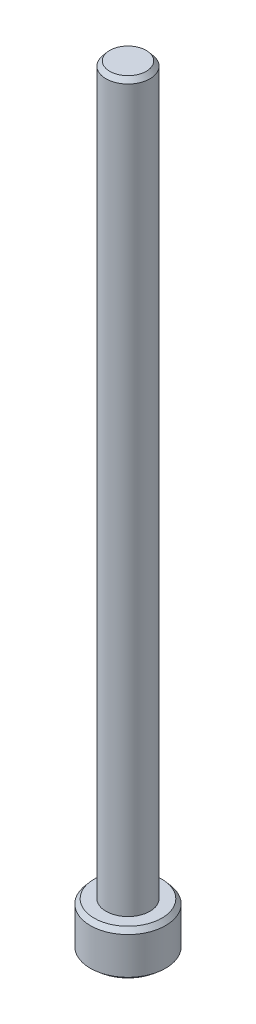
from build123d import *
from OCP.BRepFilletAPI import BRepFilletAPI_MakeChamfer

# Parameters (mm, degrees)
SKETCH1_R           = 4.15
BOSS_EXTRUDE1_DEPTH = 5
SKETCH2_R           = 2.425
BOSS_EXTRUDE2_DEPTH = 80
CUT_EXTRUDE1_DEPTH  = 3
CHAMFER1_SIZE       = 0.5
CHAMFER1_SIZE2      = 0.419549816


with BuildPart() as part:
    # Sketch1 → Boss-Extrude1 (new body)
    with BuildSketch(Plane(origin=(0, 0, 0), x_dir=(1, 0, 0), z_dir=(0, 1, 0))):
        with Locations(Location((0, 0, 0), (0, 0, 270))):
            Circle(SKETCH1_R)
    extrude(amount=BOSS_EXTRUDE1_DEPTH)

    # Sketch2 → Boss-Extrude2 (add)
    with BuildSketch(Plane(origin=(0, 5, 0), x_dir=(1, 0, 0), z_dir=(0, 1, 0))):
        with Locations(Location((0, 0, 0), (0, 0, 270))):
            Circle(SKETCH2_R)
    extrude(amount=BOSS_EXTRUDE2_DEPTH)

    # Sketch3 → Cut-Extrude1 (cut)
    with BuildSketch(Plane.XZ):
        Polygon((0, 2.786041865), (-2.412783031, 1.393020932), (-2.412783031, -1.393020932), (0, -2.786041865), (2.412783031, -1.393020932), (2.412783031, 1.393020932), align=None)
    extrude(amount=-CUT_EXTRUDE1_DEPTH, mode=Mode.SUBTRACT)

    # Chamfer1: one chamfer whose edges measure the first distance from different faces: ONE call of the kernel's chamfer builder (chamfer() names one face for all edges)
    chamfer1_edges_1 = [part.edges().sort_by_distance(p)[0] for p in [
        (0, 0, -4.15),
    ]]
    chamfer1_side_1 = [part.faces().sort_by_distance(p)[0] for p in [
        (0, 0, -4.032620274),
    ]]
    chamfer1_edges_2 = [part.edges().sort_by_distance(p)[0] for p in [
        (0, 5, -4.15),
    ]]
    chamfer1_side_2 = [part.faces().sort_by_distance(p)[0] for p in [
        (0, 2.5, -4.15),
    ]]
    chamfer1_edges_3 = [part.edges().sort_by_distance(p)[0] for p in [
        (0, 85, -2.425),
    ]]
    chamfer1_side_3 = [part.faces().sort_by_distance(p)[0] for p in [
        (0, 45, -2.425),
    ]]
    chamfer1 = BRepFilletAPI_MakeChamfer(part.part.solid().wrapped)
    for e in chamfer1_edges_1:
        chamfer1.Add(CHAMFER1_SIZE, CHAMFER1_SIZE2, e.wrapped, chamfer1_side_1[0].wrapped)  # the first distance lies on this face
    for e in chamfer1_edges_2:
        chamfer1.Add(CHAMFER1_SIZE, CHAMFER1_SIZE2, e.wrapped, chamfer1_side_2[0].wrapped)  # the first distance lies on this face
    for e in chamfer1_edges_3:
        chamfer1.Add(CHAMFER1_SIZE, CHAMFER1_SIZE2, e.wrapped, chamfer1_side_3[0].wrapped)  # the first distance lies on this face
    add(Compound.cast(chamfer1.Shape()), mode=Mode.REPLACE)


solid = part.part
